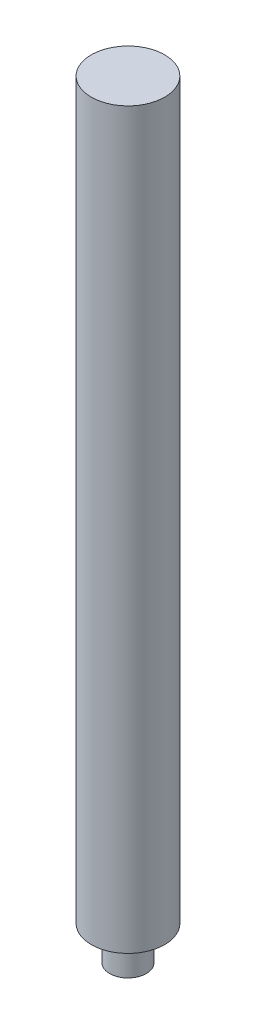
from build123d import *

# Parameters (mm, degrees)
SKETCH_1_R      = 1.5
EXTRUDE_1_DEPTH = 2.8
SKETCH_2_R      = 3
EXTRUDE_2_DEPTH = 60


with BuildPart() as part:
    # 草圖1 → 填料-伸長1 (new body)
    with BuildSketch(Plane(origin=(0, 0, 0), x_dir=(1, 0, 0), z_dir=(0, 1, 0))):
        with Locations(Location((0, 0, 0), (0, 0, 270))):
            Circle(SKETCH_1_R)
    extrude(amount=EXTRUDE_1_DEPTH)

    # 草圖2 → 填料-伸長2 (add)
    with BuildSketch(Plane(origin=(0, 2.8, 0), x_dir=(1, 0, 0), z_dir=(0, 1, 0))):
        with Locations(Location((0, 0, 0), (0, 0, 270))):
            Circle(SKETCH_2_R)
    extrude(amount=EXTRUDE_2_DEPTH)


solid = part.part
